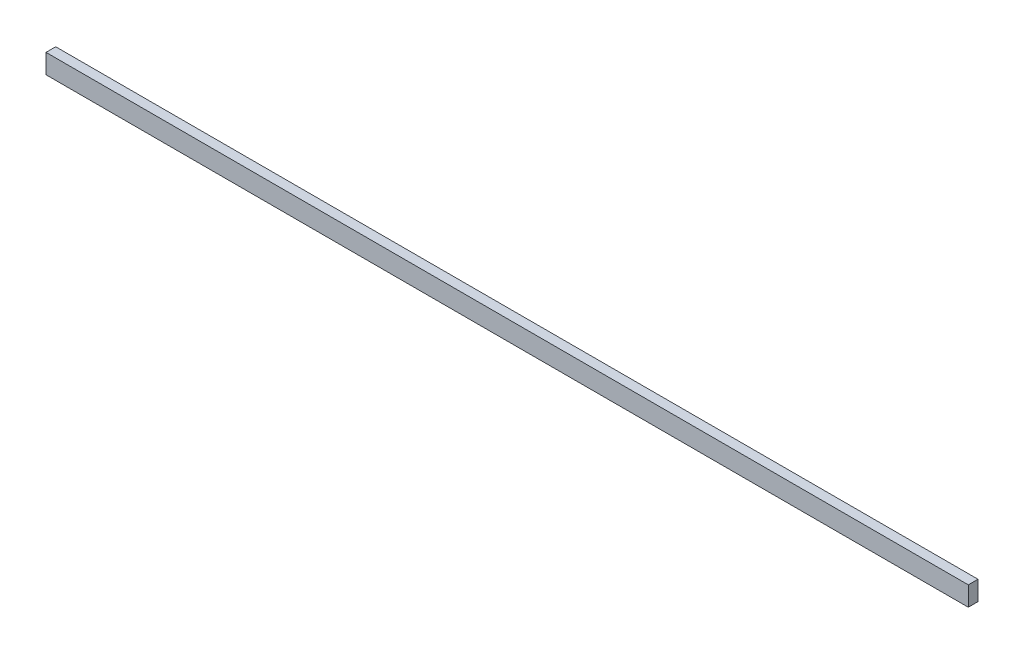
from build123d import *

# Parameters (mm, degrees)
SKETCH1_W           = 190
SKETCH1_H           = 4
BOSS_EXTRUDE1_DEPTH = 2


with BuildPart() as part:
    # Sketch1 → Boss-Extrude1 (new body)
    with BuildSketch(Plane.XY):
        Rectangle(SKETCH1_W, SKETCH1_H)
    extrude(amount=BOSS_EXTRUDE1_DEPTH)


solid = part.part
